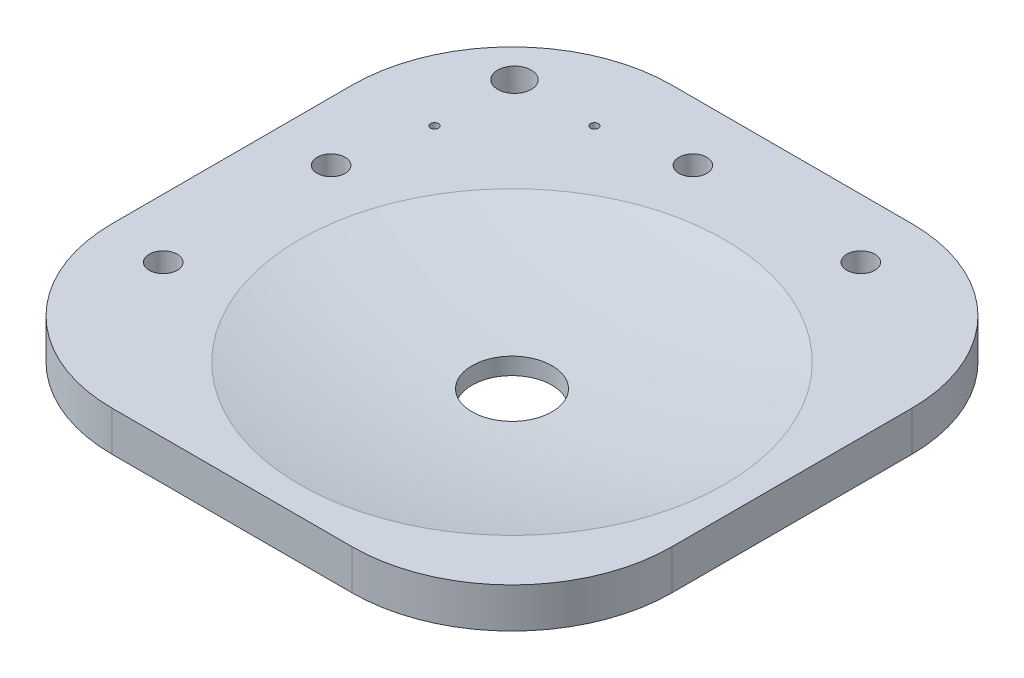
from build123d import *

# Parameters (mm, degrees)
SKETCH1_W           = 60
SKETCH1_H           = 60
BOSS_EXTRUDE1_DEPTH = 5
SKETCH2_R           = 5
CUT_EXTRUDE1_DEPTH  = 43.720018727
BOSS_EXTRUDE2_DEPTH = 5
SKETCH4_R           = 1.75
CUT_EXTRUDE2_DEPTH  = 57.789083467
FILLET1_R           = 20
SKETCH8_R           = 2.1
SKETCH8_R_2         = 0.5
CUT_EXTRUDE3_DEPTH  = 10


with BuildPart() as part:
    # Sketch1 → Boss-Extrude1 (new body)
    with BuildSketch(Plane(origin=(0, 0, 0), x_dir=(1, 0, 0), z_dir=(0, 1, 0))):
        Rectangle(SKETCH1_W, SKETCH1_H)
    extrude(amount=BOSS_EXTRUDE1_DEPTH)

    # Sketch2 → Cut-Extrude1 (cut, through all)
    with BuildSketch(Plane(origin=(0, 5, 0), x_dir=(1, 0, 0), z_dir=(0, 1, 0))):
        with Locations(Location((0, 0, 0), (0, 0, 270))):
            Circle(SKETCH2_R)
    extrude(amount=-CUT_EXTRUDE1_DEPTH, mode=Mode.SUBTRACT)

    # Sketch3 → Cut-Revolve1 (revolve, cut)
    with BuildSketch(Plane.XY):
        with BuildLine():
            Line((0, 2.007275927), (0, 240.687318419))
            ThreePointArc((0, 240.687318419), (119.340021246, 121.347297173), (0, 2.007275927))
        make_face()
    revolve(axis=Axis((0, 2.007275927, 0), (0, 1, 0)), mode=Mode.SUBTRACT)

    # Sketch5 → Boss-Extrude2 (add)
    with BuildSketch(Plane(origin=(0, 0, 0), x_dir=(1, 0, 0), z_dir=(0, 1, 0))):
        Polygon((-30, -30), (-40, -30), (-40, 40), (30, 40), (30, 30), (-30, 30), align=None)
    extrude(amount=BOSS_EXTRUDE2_DEPTH)

    # Sketch4 → Cut-Extrude2 (cut, through all)
    with BuildSketch(Plane(origin=(0, 5, 0), x_dir=(1, 0, 0), z_dir=(0, 1, 0))):
        with Locations(Location((-32.627416998, 10, 0), (0, 0, 270))):
            Circle(SKETCH4_R)
        with Locations(Location((-10, 32.627416998, 0), (0, 0, 270))):
            Circle(SKETCH4_R)
        with Locations(Location((11, 32.627416998, 0), (0, 0, 270))):
            Circle(SKETCH4_R)
        with Locations(Location((-32.627416998, -11, 0), (0, 0, 270))):
            Circle(SKETCH4_R)
    extrude(amount=-CUT_EXTRUDE2_DEPTH, mode=Mode.SUBTRACT)

    # Fillet1
    fillet1_edges = [part.edges().sort_by_distance(p)[0] for p in [
        (30, 2.5, -40),
        (-40, 2.5, -40),
        (-40, 2.5, 30),
        (30, 2.5, 30),
    ]]
    fillet(fillet1_edges, radius=FILLET1_R)

    # Sketch8 → Cut-Extrude3 (cut)
    with BuildSketch(Plane(origin=(0, 5, 0), x_dir=(1, 0, 0), z_dir=(0, 1, 0))):
        with Locations(Location((-30.428243041, 30.737374818, 0), (0, 0, 270))):
            Circle(SKETCH8_R)
        with Locations(Location((-20.428243041, 30.737374818, 0), (0, 0, 270))):
            Circle(SKETCH8_R_2)
        with Locations(Location((-30.428243041, 20.737374818, 0), (0, 0, 270))):
            Circle(SKETCH8_R_2)
    extrude(amount=-CUT_EXTRUDE3_DEPTH, mode=Mode.SUBTRACT)


solid = part.part
